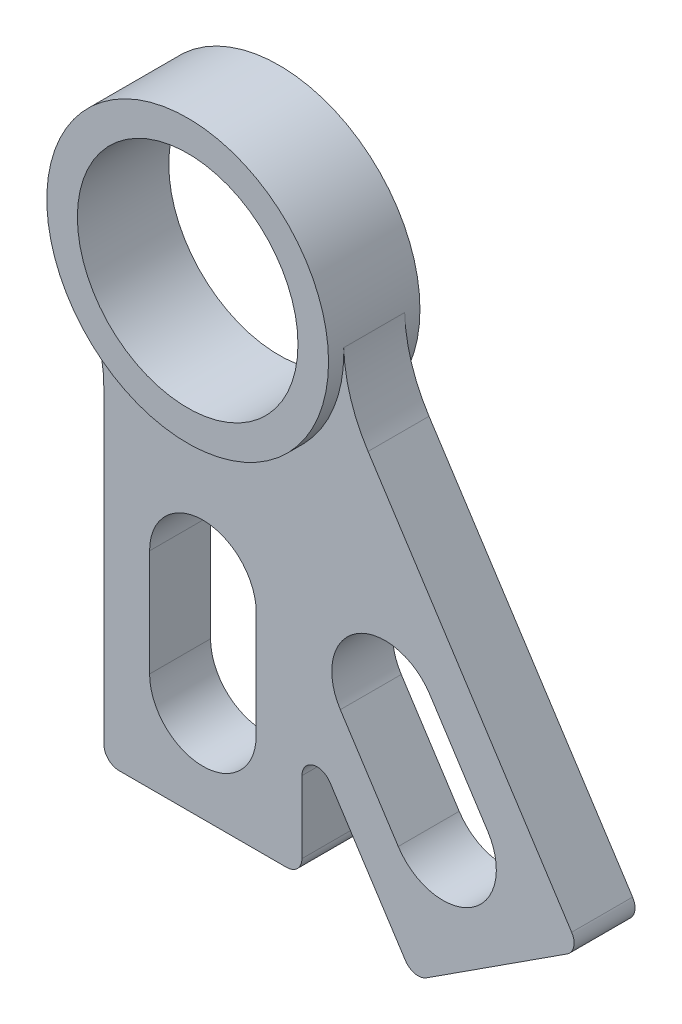
from build123d import *

# Parameters (mm, degrees)
SKETCH1_R           = 11.495405
BOSS_EXTRUDE2_DEPTH = 4.7625
BOSS_EXTRUDE3_DEPTH = 3.175
FILLET1_R           = 1.5875


with BuildPart() as part:
    # Sketch1 → Boss-Extrude2 (new, symmetric)
    with BuildSketch(Plane.XY):
        with BuildLine():
            ThreePointArc((14.672983865, 0.491098707), (-4.158599684, 14.079903484), (-12.585193267, -7.559797873))
            ThreePointArc((-12.585193267, -7.559797873), (4.158599684, -14.079903484), (14.672983865, 0.491098707))
        make_face()
        Circle(SKETCH1_R, mode=Mode.SUBTRACT)
    extrude(amount=BOSS_EXTRUDE2_DEPTH, both=True)

    # Sketch1<4> → Boss-Extrude3 (add, symmetric)
    with BuildSketch(Plane.XY):
        with BuildLine():
            ThreePointArc((-12.585193267, -7.559797873), (-10.89585042, -11.492870345), (-10.31875, -15.734319794))
            Line((-10.31875, -15.734319794), (-10.31875, -49.389319794))
            Line((-10.31875, -49.389319794), (10.31875, -49.389319794))
            Line((10.31875, -49.389319794), (10.31875, -34.936520731))
            Line((10.31875, -34.936520731), (21.966281014, -52.934138627))
            Line((21.966281014, -52.934138627), (39.292025986, -41.721424085))
            Line((39.292025986, -41.721424085), (17.211603503, -7.603033986))
            ThreePointArc((17.211603503, -7.603033986), (15.391641433, -3.728672569), (14.672983865, 0.491098707))
            ThreePointArc((14.672983865, 0.491098707), (4.158599684, -14.079903484), (-12.585193267, -7.559797873))
        make_face()
        with BuildLine():
            ThreePointArc((5.55625, -39.070569794), (0, -44.626819794), (-5.55625, -39.070569794))
            Line((-5.55625, -39.070569794), (-5.55625, -27.958069794))
            ThreePointArc((-5.55625, -27.958069794), (0, -22.401819794), (5.55625, -27.958069794))
            Line((5.55625, -27.958069794), (5.55625, -39.070569794))
        make_face(mode=Mode.SUBTRACT)
        with BuildLine():
            ThreePointArc((29.687419875, -35.646101109), (28.04160399, -43.329532516), (20.358172583, -41.683716631))
            Line((20.358172583, -41.683716631), (14.32055706, -32.354469339))
            ThreePointArc((14.32055706, -32.354469339), (15.966372945, -24.671037931), (23.649804353, -26.316853816))
            Line((23.649804353, -26.316853816), (29.687419875, -35.646101109))
        make_face(mode=Mode.SUBTRACT)
    extrude(amount=BOSS_EXTRUDE3_DEPTH, both=True)

    # Fillet1
    fillet1_edges = [part.edges().sort_by_distance(p)[0] for p in [
        (-10.31875, -49.389319794, 0),
        (39.292025986, -41.721424085, 0),
        (10.31875, -49.389319794, 0),
        (21.966281014, -52.934138627, 0),
        (10.31875, -34.936520731, 0),
    ]]
    fillet(fillet1_edges, radius=FILLET1_R)


solid = part.part
